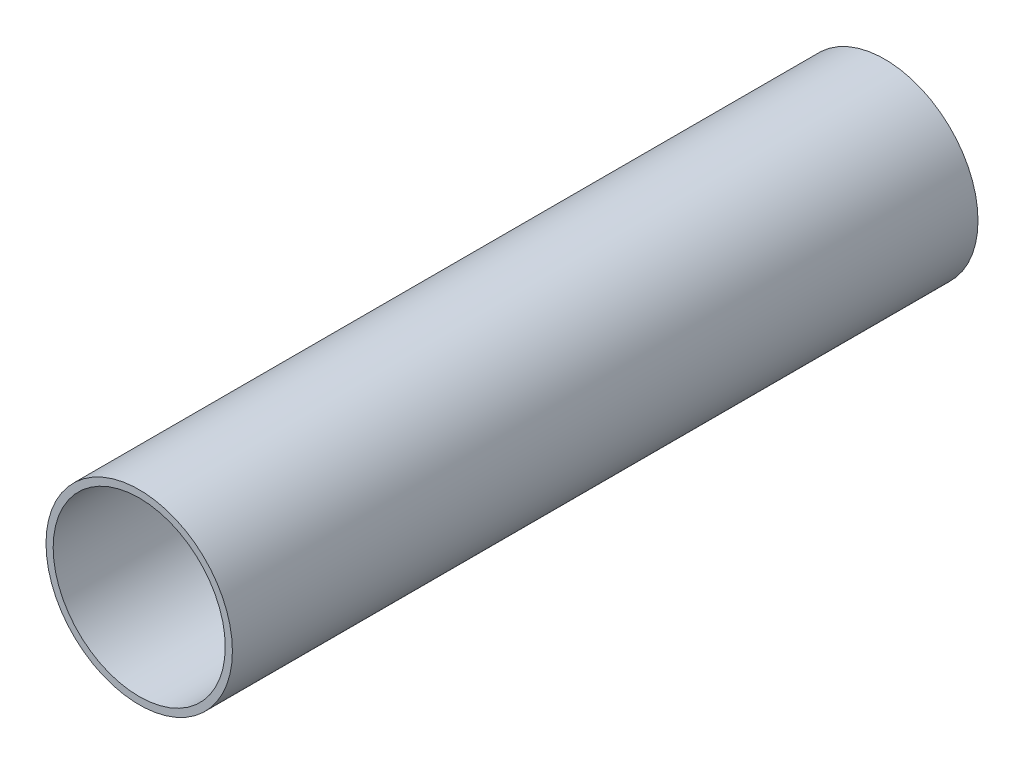
from build123d import *

# Parameters (mm, degrees)
SKETCH1_R           = 12.5
SKETCH1_R_2         = 11.54
BOSS_EXTRUDE2_DEPTH = 100


with BuildPart() as part:
    # Sketch1 → Boss-Extrude2 (new body)
    with BuildSketch(Plane.XY):
        Circle(SKETCH1_R)
        Circle(SKETCH1_R_2, mode=Mode.SUBTRACT)
    extrude(amount=BOSS_EXTRUDE2_DEPTH)


solid = part.part
